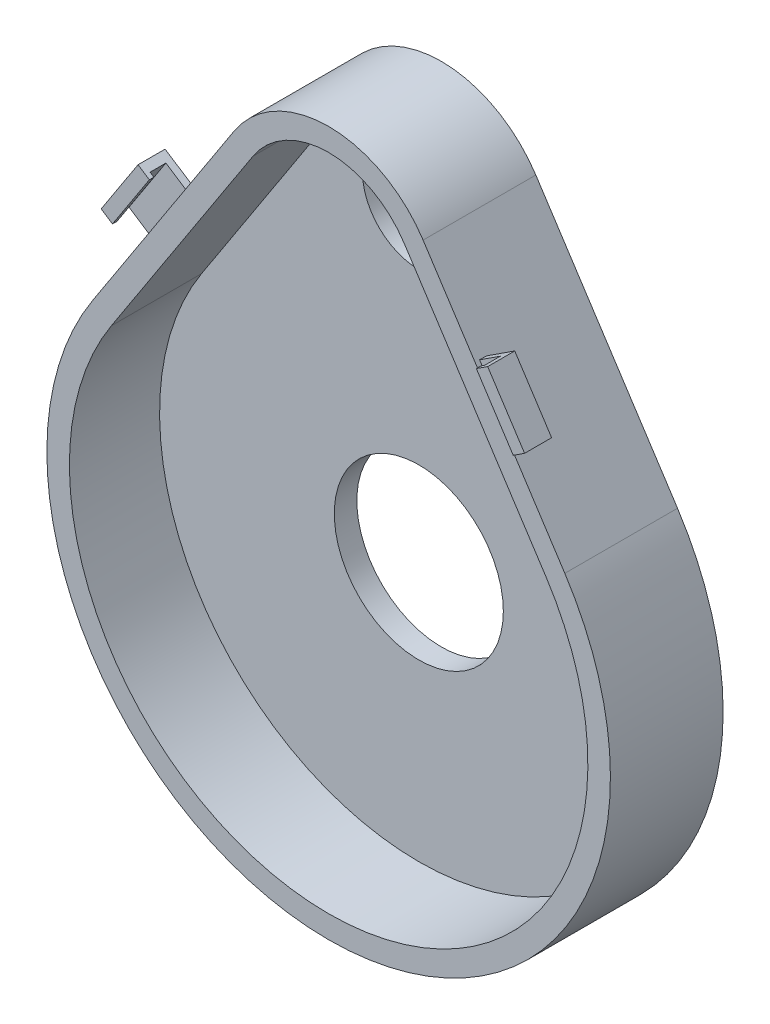
from build123d import *

# Parameters (mm, degrees)
BOSS_EXTRUDE2_DEPTH = 6.35
SHELL3_T            = -1.27
SKETCH2_7_R         = 4.7625
SKETCH2_7_R_2       = 3.175
CUT_EXTRUDE2_DEPTH  = 30.315069184
BOSS_EXTRUDE3_DEPTH = 1.524
CUT_EXTRUDE3_REACH  = 34.391


with BuildPart() as part:
    # Sketch2 → Boss-Extrude2 (new body)
    with BuildSketch(Plane(origin=(0, 0, 0), x_dir=(0, 1, 0), z_dir=(0, 0, 1))):
        with BuildLine():
            Line((8.659090909, -13.305478933), (20.926136364, -5.322191573))
            ThreePointArc((20.926136364, -5.322191573), (23.8125, 0), (20.926136364, 5.322191573))
            Line((20.926136364, 5.322191573), (8.659090909, 13.305478933))
            ThreePointArc((8.659090909, 13.305478933), (-15.875, 0), (8.659090909, -13.305478933))
        make_face()
    extrude(amount=BOSS_EXTRUDE2_DEPTH)

    # Shell3
    shell3_openings = [part.faces().sort_by_distance(p)[0] for p in [
        (0, 2.303090429, 6.35),
    ]]
    offset(amount=SHELL3_T, openings=shell3_openings, kind=Kind.INTERSECTION)

    # Sketch2<7> → Cut-Extrude2 (cut, through all)
    with BuildSketch(Plane(origin=(0, 0, 0), x_dir=(0, 1, 0), z_dir=(0, 0, 1))):
        Circle(SKETCH2_7_R)
        with Locations((17.4625, 0)):
            Circle(SKETCH2_7_R_2)
    extrude(amount=CUT_EXTRUDE2_DEPTH, mode=Mode.SUBTRACT)

    # Sketch6 → Boss-Extrude3 (add)
    with BuildSketch(Plane(origin=(0, 0, 5.715), x_dir=(0, -1, 0), z_dir=(0, 0, 1))):
        Polygon((-16.423409091, 8.252527639), (-17.4625, 9.849185111), (-14.269185056, 11.927366929), (-13.230094147, 10.330709457), align=None)
        Polygon((-14.269185056, -11.927366929), (-13.230094147, -10.330709457), (-16.423409091, -8.252527639), (-17.4625, -9.849185111), align=None)
    extrude(amount=BOSS_EXTRUDE3_DEPTH)

    # Sketch8 → Cut-Extrude3 (cut, up to next)
    with BuildSketch(Plane(origin=(-5.052951293, 7.764318182, 0), x_dir=(-0.8381404052084441, -0.5454545454545457, 0), z_dir=(-0.5454545454545457, 0.8381404052084441, 0)), mode=Mode.PRIVATE) as cut_extrude3_sk1:
        Polygon((-17.272, 6.985), (-17.018, 6.985), (-17.018, 7.239), (-15.875, 7.239), (-15.875, 6.35), (-15.875, 6.096), (-17.272, 6.096), align=None)
    cut_extrude3_tool1 = extrude(cut_extrude3_sk1.sketch, amount=-CUT_EXTRUDE3_REACH, mode=Mode.PRIVATE) & part.part
    cut_extrude3 = cut_extrude3_tool1.solids().sort_by_distance((8.8178, 16.791284, 6.648784))[0]
    add(cut_extrude3, mode=Mode.SUBTRACT)

    # Mirror1: Cut-Extrude3 across plane
    add(cut_extrude3.mirror(Plane(origin=(0, 0, 0), x_dir=(0, 0, 1), z_dir=(1, 0, 0))), mode=Mode.SUBTRACT)


solid = part.part
